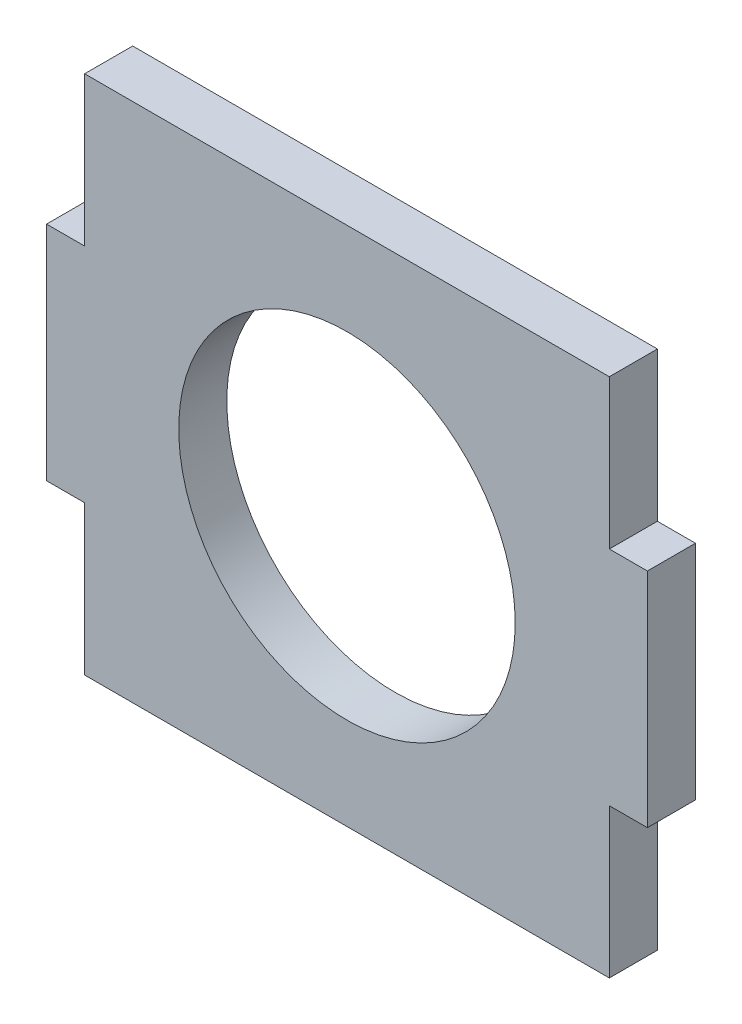
from build123d import *

# Parameters (mm, degrees)
CROQUIS1_W              = 15
CROQUIS1_H              = 13
SALIENTE_EXTRUIR1_DEPTH = 1.2
CORTAR_EXTRUIR1_REACH   = 11.997
CROQUIS2_W              = 0.95
CROQUIS2_H              = 3.725
CORTAR_EXTRUIR2_REACH   = 11.997
CROQUIS3_R              = 4.2


with BuildPart() as part:
    # Croquis1 → Saliente-Extruir1 (new body)
    with BuildSketch(Plane.XY):
        Rectangle(CROQUIS1_W, CROQUIS1_H)
    extrude(amount=SALIENTE_EXTRUIR1_DEPTH)

    # Croquis2 → Cortar-Extruir1 (cut, up to next)
    with BuildSketch(Plane.XY.offset(1.2), mode=Mode.PRIVATE) as cortar_extruir1_sk1:
        with Locations((7.025, 4.6375)):
            Rectangle(CROQUIS2_W, CROQUIS2_H)
    cortar_extruir1_tool1 = extrude(cortar_extruir1_sk1.sketch, amount=-CORTAR_EXTRUIR1_REACH, mode=Mode.PRIVATE) & part.part
    # Croquis2 → Cortar-Extruir1 (cut, up to next)
    with BuildSketch(Plane.XY.offset(1.2), mode=Mode.PRIVATE) as cortar_extruir1_sk2:
        with Locations((7.025, -4.6375)):
            Rectangle(CROQUIS2_W, CROQUIS2_H)
    cortar_extruir1_tool2 = extrude(cortar_extruir1_sk2.sketch, amount=-CORTAR_EXTRUIR1_REACH, mode=Mode.PRIVATE) & part.part
    # Croquis2 → Cortar-Extruir1 (cut, up to next)
    with BuildSketch(Plane.XY.offset(1.2), mode=Mode.PRIVATE) as cortar_extruir1_sk3:
        with Locations((-7.025, -4.6375)):
            Rectangle(CROQUIS2_W, CROQUIS2_H)
    cortar_extruir1_tool3 = extrude(cortar_extruir1_sk3.sketch, amount=-CORTAR_EXTRUIR1_REACH, mode=Mode.PRIVATE) & part.part
    # Croquis2 → Cortar-Extruir1 (cut, up to next)
    with BuildSketch(Plane.XY.offset(1.2), mode=Mode.PRIVATE) as cortar_extruir1_sk4:
        with Locations((-7.025, 4.6375)):
            Rectangle(CROQUIS2_W, CROQUIS2_H)
    cortar_extruir1_tool4 = extrude(cortar_extruir1_sk4.sketch, amount=-CORTAR_EXTRUIR1_REACH, mode=Mode.PRIVATE) & part.part
    add(cortar_extruir1_tool1.solids().sort_by_distance((7.025, 4.6375, 1.2))[0], mode=Mode.SUBTRACT)
    add(cortar_extruir1_tool2.solids().sort_by_distance((7.025, -4.6375, 1.2))[0], mode=Mode.SUBTRACT)
    add(cortar_extruir1_tool3.solids().sort_by_distance((-7.025, -4.6375, 1.2))[0], mode=Mode.SUBTRACT)
    add(cortar_extruir1_tool4.solids().sort_by_distance((-7.025, 4.6375, 1.2))[0], mode=Mode.SUBTRACT)

    # Croquis3 → Cortar-Extruir2 (cut, up to next)
    with BuildSketch(Plane.XY.offset(1.2), mode=Mode.PRIVATE) as cortar_extruir2_sk1:
        Circle(CROQUIS3_R)
    cortar_extruir2_tool1 = extrude(cortar_extruir2_sk1.sketch, amount=-CORTAR_EXTRUIR2_REACH, mode=Mode.PRIVATE) & part.part
    add(cortar_extruir2_tool1.solids().sort_by_distance((0, 0, 1.2))[0], mode=Mode.SUBTRACT)


solid = part.part
